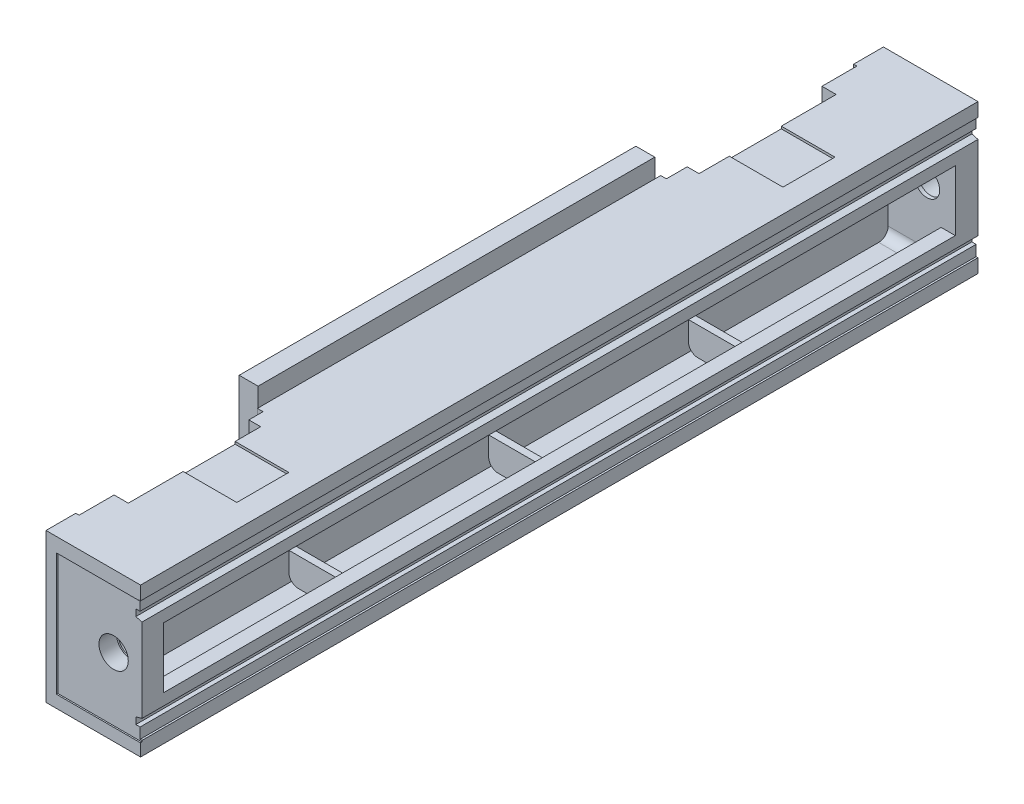
from build123d import *

# Parameters (mm, degrees)
EXTRUDE_1_DEPTH          = 1771
EXTRUDE_START            = -448.5
EXTRUDE_2_DEPTH          = 839
CUT_EXTRUDE_START        = -48
SKETCH_2_W               = 112
SKETCH_2_H               = 275
CUT_EXTRUDE_1_DEPTH      = 1675
SKETCH_3_W               = 1675
SKETCH_3_H               = 128
CUT_EXTRUDE_2_DEPTH      = 30
FILLET_1_R               = 20
SKETCH_6_R               = 54
CUT_EXTRUDE_3_DEPTH      = 3
SKETCH_7_R               = 31
CUT_EXTRUDE_4_DEPTH      = 37
SKETCH_8_R               = 27
CUT_EXTRUDE_6_DEPTH      = 8
EXTRUDE_START_2          = -455.5
EXTRUDE_3_DEPTH          = 15
PATTERN_LINEAR_1_COUNT   = 3
PATTERN_LINEAR_1_PITCH   = 422.5
CUT_EXTRUDE_7_DEPTH      = 1814.665928779
CUT_EXTRUDE_7_DEPTH_BACK = 3
CUT_EXTRUDE_START_2      = -37
SKETCH_15_R              = 31
CUT_EXTRUDE_8_DEPTH      = 37
CUT_EXTRUDE_START_3      = -8
SKETCH_16_R              = 27
CUT_EXTRUDE_9_DEPTH      = 8
CUT_EXTRUDE_START_4      = -468.5
CUT_EXTRUDE_10_DEPTH     = 394.5
PATTERN_LINEAR_2_COUNT   = 2
PATTERN_LINEAR_2_PITCH   = 409.5
CUT_EXTRUDE_START_5      = -253
SKETCH_19_W              = 150.5
SKETCH_19_H              = 5
CUT_EXTRUDE_11_DEPTH     = 110
PATTERN_LINEAR_3_COUNT   = 2
PATTERN_LINEAR_3_PITCH   = 1155
FILLET_2_R               = 20
CUT_EXTRUDE_12_DEPTH     = 315
SKETCH_22_W              = 12
SKETCH_22_H              = 24
CUT_EXTRUDE_14_DEPTH     = 315
SKETCH_23_W              = 25
SKETCH_23_H              = 10
CUT_EXTRUDE_15_DEPTH     = 315


with BuildPart() as part:
    # 草图1 → 凸台-拉伸1 (new body)
    with BuildSketch(Plane.XY):
        Polygon((23.238095238, 29.489051095), (-176.761904762, 29.489051095), (-176.761904762, -128.010948905), (23.238095238, -128.010948905), (23.238095238, -39.760948905), (10.238095238, -36.280948905), (10.238095238, -22.010948905), (19.238095238, -22.010948905), (19.238095238, 0.489051095), (23.238095238, 0.489051095), align=None)
        Polygon((23.238095238, -128.010948905), (-176.761904762, -128.010948905), (-176.761904762, -285.510948905), (23.238095238, -285.510948905), (23.238095238, -256.510948905), (19.238095238, -256.510948905), (19.238095238, -234.010948905), (10.238095238, -234.010948905), (10.238095238, -219.740948905), (23.238095238, -216.260948905), align=None)
    extrude(amount=-EXTRUDE_1_DEPTH)

    # 草图1<3> → 凸台-拉伸2 (add)
    with BuildSketch(Plane.XY.offset(EXTRUDE_START)):
        Polygon((-176.761904762, 29.489051095), (-176.761904762, 69.489051095), (-216.761904762, 69.489051095), (-216.761904762, -128.010948905), (-176.761904762, -128.010948905), align=None)
        Polygon((-176.761904762, -128.010948905), (-216.761904762, -128.010948905), (-216.761904762, -325.510948905), (-176.761904762, -325.510948905), (-176.761904762, -285.510948905), align=None)
    extrude(amount=-EXTRUDE_2_DEPTH)

    # 草图2 → 切除-拉伸1 (cut)
    with BuildSketch(Plane.XY.offset(CUT_EXTRUDE_START)):
        with Locations((-62.761904762, -128.010948905)):
            Rectangle(SKETCH_2_W, SKETCH_2_H)
    extrude(amount=-CUT_EXTRUDE_1_DEPTH, mode=Mode.SUBTRACT)

    # 草图3 → 切除-拉伸2 (cut)
    with BuildSketch(Plane(origin=(23.238095238, 0, 0), x_dir=(0, 0, -1), z_dir=(1, 0, 0))):
        with Locations((885.5, -128.010948905)):
            Rectangle(SKETCH_3_W, SKETCH_3_H)
    extrude(amount=-CUT_EXTRUDE_2_DEPTH, mode=Mode.SUBTRACT)

    # 圆角1
    fillet_1_edges = [part.edges().sort_by_distance(p)[0] for p in [
        (-62.761904762, 9.489051095, -1723),
        (-62.761904762, 9.489051095, -48),
        (-62.761904762, -265.510948905, -1723),
        (-62.761904762, -265.510948905, -48),
    ]]
    fillet(fillet_1_edges, radius=FILLET_1_R)

    # 草图6 → 切除-拉伸3 (cut)
    with BuildSketch(Plane(origin=(0, 0, -1771), x_dir=(-1, 0, 0), z_dir=(0, 0, -1))):
        with Locations((36.761904762, -125.510948905)):
            Circle(SKETCH_6_R)
    extrude(amount=-CUT_EXTRUDE_3_DEPTH, mode=Mode.SUBTRACT)

    # 草图7 → 切除-拉伸4 (cut)
    with BuildSketch(Plane(origin=(0, 0, -1768), x_dir=(-1, 0, 0), z_dir=(0, 0, -1))):
        with Locations((36.761904762, -125.510948905)):
            Circle(SKETCH_7_R)
    extrude(amount=-CUT_EXTRUDE_4_DEPTH, mode=Mode.SUBTRACT)

    # 草图8 → 切除-拉伸6 (cut)
    with BuildSketch(Plane(origin=(0, 0, -1731), x_dir=(-1, 0, 0), z_dir=(0, 0, -1))):
        with Locations((36.761904762, -125.510948905)):
            Circle(SKETCH_8_R)
    extrude(amount=-CUT_EXTRUDE_6_DEPTH, mode=Mode.SUBTRACT)

    # 草图11 → 凸台-拉伸3 (add)
    with BuildSketch(Plane.XY.offset(EXTRUDE_START_2)):
        with BuildLine():
            Line((-98.761904762, 9.489051095), (-26.761904762, 9.489051095))
            ThreePointArc((-26.761904762, 9.489051095), (-12.619769138, 3.631186719), (-6.761904762, -10.510948905))
            Line((-6.761904762, -10.510948905), (-6.761904762, -50.510948905))
            Line((-6.761904762, -50.510948905), (-118.761904762, -50.510948905))
            Line((-118.761904762, -50.510948905), (-118.761904762, -10.510948905))
            ThreePointArc((-118.761904762, -10.510948905), (-112.904040386, 3.631186719), (-98.761904762, 9.489051095))
        make_face()
        with BuildLine():
            Line((-118.761904762, -245.510948905), (-118.761904762, -205.510948905))
            Line((-118.761904762, -205.510948905), (-6.761904762, -205.510948905))
            Line((-6.761904762, -205.510948905), (-6.761904762, -245.510948905))
            ThreePointArc((-6.761904762, -245.510948905), (-12.619769138, -259.653084529), (-26.761904762, -265.510948905))
            Line((-26.761904762, -265.510948905), (-98.761904762, -265.510948905))
            ThreePointArc((-98.761904762, -265.510948905), (-112.904040386, -259.653084529), (-118.761904762, -245.510948905))
        make_face()
    extrude_3 = extrude(amount=-EXTRUDE_3_DEPTH)

    # 阵列(线性)1: 凸台-拉伸3 ×3
    with Locations(*[(0, 0, -i * PATTERN_LINEAR_1_PITCH) for i in range(1, PATTERN_LINEAR_1_COUNT)]):
        add(extrude_3)

    # 草图14 → 切除-拉伸7 (cut, two sides: drawn at the far end of the back side and taken through both)
    with BuildSketch(Plane.XY.offset(-CUT_EXTRUDE_7_DEPTH_BACK)):
        Polygon((19.238095238, -0.510948905), (-154.761904762, -0.510948905), (-154.761904762, -259.510948905), (23.238095238, -259.510948905), (23.238095238, -256.510948905), (19.238095238, -256.510948905), (19.238095238, -234.010948905), (10.238095238, -234.010948905), (10.238095238, -219.740948905), (23.238095238, -216.260948905), (23.238095238, -39.760948905), (10.238095238, -36.280948905), (10.238095238, -22.010948905), (19.238095238, -22.010948905), align=None)
    extrude(amount=CUT_EXTRUDE_7_DEPTH + CUT_EXTRUDE_7_DEPTH_BACK, mode=Mode.SUBTRACT)

    # 草图15 → 切除-拉伸8 (cut)
    with BuildSketch(Plane.XY.offset(-3).offset(CUT_EXTRUDE_START_2)):
        with Locations(Location((-36.761904762, -125.510948905, 0), (0, 0, 180))):
            Circle(SKETCH_15_R)
    extrude(amount=CUT_EXTRUDE_8_DEPTH, mode=Mode.SUBTRACT)

    # 草图16 → 切除-拉伸9 (cut)
    with BuildSketch(Plane.XY.offset(-40).offset(CUT_EXTRUDE_START_3)):
        with Locations(Location((-36.761904762, -125.510948905, 0), (0, 0, 180))):
            Circle(SKETCH_16_R)
    extrude(amount=CUT_EXTRUDE_9_DEPTH, mode=Mode.SUBTRACT)

    # 草图17 → 切除-拉伸10 (cut)
    with BuildSketch(Plane.XY.offset(CUT_EXTRUDE_START_4)):
        with BuildLine():
            Line((-216.761904762, -10.510948905), (-158.761904762, -10.510948905))
            ThreePointArc((-158.761904762, -10.510948905), (-144.619769138, -16.368813281), (-138.761904762, -30.510948905))
            Line((-138.761904762, -30.510948905), (-138.761904762, -98.010948905))
            ThreePointArc((-138.761904762, -98.010948905), (-144.619769138, -112.153084529), (-158.761904762, -118.010948905))
            Line((-158.761904762, -118.010948905), (-216.761904762, -118.010948905))
            Line((-216.761904762, -118.010948905), (-216.761904762, -10.510948905))
        make_face()
        with BuildLine():
            Line((-216.761904762, -245.510948905), (-216.761904762, -138.010948905))
            Line((-216.761904762, -138.010948905), (-158.761904762, -138.010948905))
            ThreePointArc((-158.761904762, -138.010948905), (-144.619769138, -143.868813281), (-138.761904762, -158.010948905))
            Line((-138.761904762, -158.010948905), (-138.761904762, -225.510948905))
            ThreePointArc((-138.761904762, -225.510948905), (-144.619769138, -239.653084529), (-158.761904762, -245.510948905))
            Line((-158.761904762, -245.510948905), (-216.761904762, -245.510948905))
        make_face()
    cut_extrude_10 = extrude(amount=-CUT_EXTRUDE_10_DEPTH, mode=Mode.SUBTRACT)

    # 阵列(线性)2: 切除-拉伸10 ×2
    with Locations(*[(0, 0, -i * PATTERN_LINEAR_2_PITCH) for i in range(1, PATTERN_LINEAR_2_COUNT)]):
        add(cut_extrude_10, mode=Mode.SUBTRACT)

    # 草图19 → 切除-拉伸11 (cut)
    with BuildSketch(Plane.XY.offset(CUT_EXTRUDE_START_5)):
        with Locations((-101.511904762, 26.989051095)):
            Rectangle(SKETCH_19_W, SKETCH_19_H)
    cut_extrude_11 = extrude(amount=-CUT_EXTRUDE_11_DEPTH, mode=Mode.SUBTRACT)

    # 阵列(线性)3: 切除-拉伸11 ×2
    with Locations(*[(0, 0, -i * PATTERN_LINEAR_3_PITCH) for i in range(1, PATTERN_LINEAR_3_COUNT)]):
        add(cut_extrude_11, mode=Mode.SUBTRACT)

    # 圆角2
    fillet_2_edges = [part.edges().sort_by_distance(p)[0] for p in [
        (-187.761904762, -10.510948905, -863),
        (-144.619769138, -16.368813281, -863),
        (-138.761904762, -64.260948905, -863),
        (-144.619769138, -112.153084529, -863),
        (-187.761904762, -118.010948905, -863),
        (-187.761904762, -118.010948905, -468.5),
        (-144.619769138, -112.153084529, -468.5),
        (-138.761904762, -64.260948905, -468.5),
        (-144.619769138, -16.368813281, -468.5),
        (-187.761904762, -10.510948905, -468.5),
        (-187.761904762, -245.510948905, -863),
        (-187.761904762, -138.010948905, -863),
        (-144.619769138, -143.868813281, -863),
        (-138.761904762, -191.760948905, -863),
        (-144.619769138, -239.653084529, -863),
        (-187.761904762, -245.510948905, -468.5),
        (-144.619769138, -239.653084529, -468.5),
        (-138.761904762, -191.760948905, -468.5),
        (-144.619769138, -143.868813281, -468.5),
        (-187.761904762, -138.010948905, -468.5),
        (-187.761904762, -10.510948905, -1272.5),
        (-144.619769138, -16.368813281, -1272.5),
        (-138.761904762, -64.260948905, -1272.5),
        (-144.619769138, -112.153084529, -1272.5),
        (-187.761904762, -118.010948905, -1272.5),
        (-187.761904762, -118.010948905, -878),
        (-144.619769138, -112.153084529, -878),
        (-138.761904762, -64.260948905, -878),
        (-144.619769138, -16.368813281, -878),
        (-187.761904762, -10.510948905, -878),
        (-187.761904762, -245.510948905, -1272.5),
        (-187.761904762, -138.010948905, -1272.5),
        (-144.619769138, -143.868813281, -1272.5),
        (-138.761904762, -191.760948905, -1272.5),
        (-144.619769138, -239.653084529, -1272.5),
        (-187.761904762, -245.510948905, -878),
        (-144.619769138, -239.653084529, -878),
        (-138.761904762, -191.760948905, -878),
        (-144.619769138, -143.868813281, -878),
        (-187.761904762, -138.010948905, -878),
    ]]
    fillet(fillet_2_edges, radius=FILLET_2_R)

    # 草图21 → 切除-拉伸12 (cut)
    with BuildSketch(Plane(origin=(0, 29.489051095, 0), x_dir=(1, 0, 0), z_dir=(0, 1, 0))):
        Polygon((-176.761904762, 63), (-169.761904762, 63), (-169.761904762, 137), (-139.761904762, 137), (-139.761904762, 417), (-164.761904762, 417), (-164.761904762, 447), (-176.761904762, 447), align=None)
        Polygon((-176.761904762, 1324), (-176.761904762, 1708), (-169.761904762, 1708), (-169.761904762, 1634), (-139.761904762, 1634), (-139.761904762, 1354), (-164.761904762, 1354), (-164.761904762, 1324), align=None)
    extrude(amount=-CUT_EXTRUDE_12_DEPTH, mode=Mode.SUBTRACT)

    # 草图22 → 切除-拉伸14 (cut)
    with BuildSketch(Plane(origin=(0, 29.489051095, 0), x_dir=(1, 0, 0), z_dir=(0, 1, 0))):
        with Locations((-170.761904762, 1312)):
            Rectangle(SKETCH_22_W, SKETCH_22_H)
    extrude(amount=-CUT_EXTRUDE_14_DEPTH, mode=Mode.SUBTRACT)

    # 草图23 → 切除-拉伸15 (cut)
    with BuildSketch(Plane(origin=(0, 29.489051095, 0), x_dir=(1, 0, 0), z_dir=(0, 1, 0))):
        with Locations((-152.261904762, 1349)):
            Rectangle(SKETCH_23_W, SKETCH_23_H)
    extrude(amount=-CUT_EXTRUDE_15_DEPTH, mode=Mode.SUBTRACT)


solid = part.part
